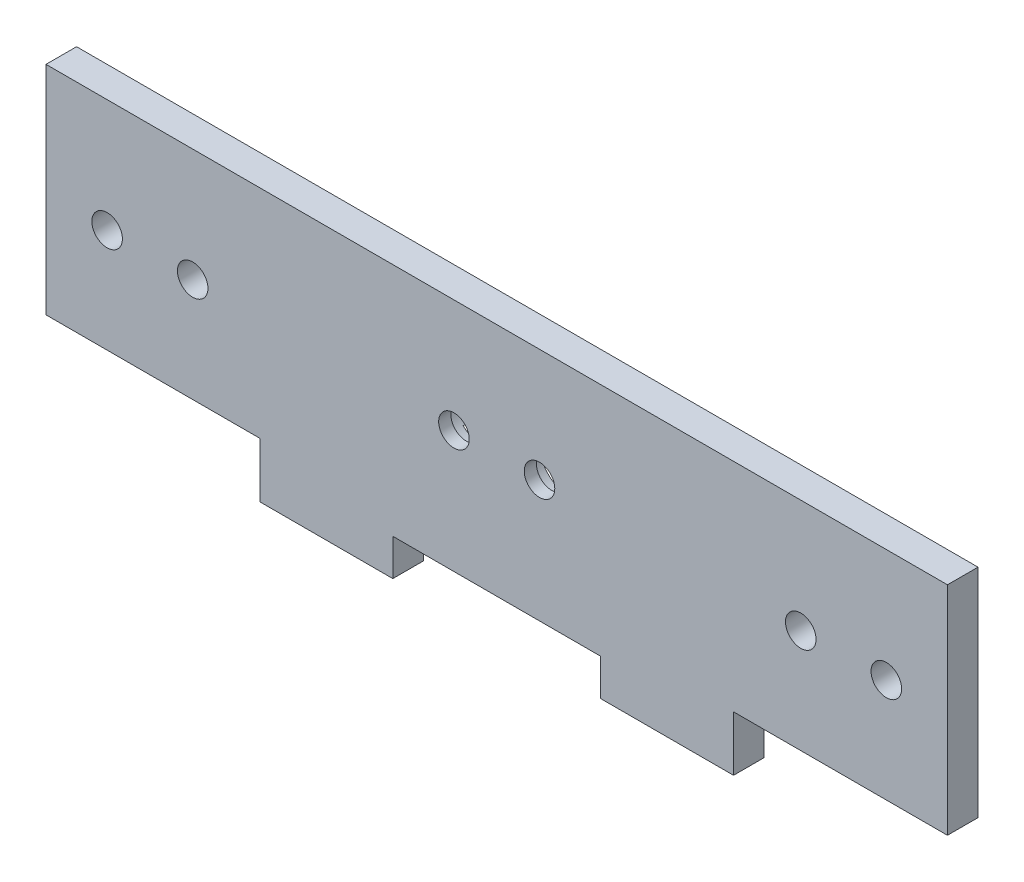
from build123d import *

# Parameters (mm, degrees)
SKETCH1_W           = 147.5
SKETCH1_H           = 53.5
BOSS_EXTRUDE1_DEPTH = 5
SKETCH2_R           = 5
BOSS_EXTRUDE2_DEPTH = 7
SKETCH3_W           = 35
SKETCH3_H           = 18
CUT_EXTRUDE1_DEPTH  = 80.363877173
SKETCH4_W           = 34
SKETCH4_H           = 15
CUT_EXTRUDE2_DEPTH  = 10
SKETCH5_R           = 2.5
CUT_EXTRUDE3_DEPTH  = 80.363877173
SKETCH6_R           = 5
CUT_EXTRUDE4_DEPTH  = 10
SKETCH7_W           = 77.5
SKETCH7_H           = 9
CUT_EXTRUDE5_DEPTH  = 10


with BuildPart() as part:
    # Sketch1 → Boss-Extrude1 (new body)
    with BuildSketch(Plane.XY):
        Rectangle(SKETCH1_W, SKETCH1_H)
    extrude(amount=BOSS_EXTRUDE1_DEPTH)

    # Sketch2 → Boss-Extrude2 (add)
    with BuildSketch(Plane(origin=(0, 0, 0), x_dir=(-1, 0, 0), z_dir=(0, 0, -1))):
        with Locations(Location((12.5, 9.25, 0), (0, 0, 180))):
            Circle(SKETCH2_R)
        with Locations(Location((-12.5, 9.25, 0), (0, 0, 180))):
            Circle(SKETCH2_R)
    extrude(amount=BOSS_EXTRUDE2_DEPTH)

    # Sketch3 → Cut-Extrude1 (cut, through all)
    with BuildSketch(Plane.XY.offset(5)):
        with Locations((-56.25, -17.75)):
            Rectangle(SKETCH3_W, SKETCH3_H)
        with Locations((56.25, -17.75)):
            Rectangle(SKETCH3_W, SKETCH3_H)
    extrude(amount=-CUT_EXTRUDE1_DEPTH, mode=Mode.SUBTRACT)

    # Sketch4 → Cut-Extrude2 (cut)
    with BuildSketch(Plane.XY.offset(5)):
        with Locations((0, -19.25)):
            Rectangle(SKETCH4_W, SKETCH4_H)
    extrude(amount=-CUT_EXTRUDE2_DEPTH, mode=Mode.SUBTRACT)

    # Sketch5 → Cut-Extrude3 (cut, through all)
    with BuildSketch(Plane.XY.offset(5)):
        with Locations((63.75, 8.25)):
            Circle(SKETCH5_R)
        with Locations((49.75, 8.25)):
            Circle(SKETCH5_R)
        with Locations((7, 8.25)):
            Circle(SKETCH5_R)
        with Locations((-49.75, 8.25)):
            Circle(SKETCH5_R)
        with Locations((-63.75, 8.25)):
            Circle(SKETCH5_R)
        with Locations((-7, 8.25)):
            Circle(SKETCH5_R)
    extrude(amount=-CUT_EXTRUDE3_DEPTH, mode=Mode.SUBTRACT)

    # Sketch6 → Cut-Extrude4 (cut)
    with BuildSketch(Plane(origin=(0, 0, -7), x_dir=(-1, 0, 0), z_dir=(0, 0, -1))):
        with Locations((7, 8.25)):
            Circle(SKETCH6_R)
        with Locations((-7, 8.25)):
            Circle(SKETCH6_R)
    extrude(amount=-CUT_EXTRUDE4_DEPTH, mode=Mode.SUBTRACT)

    # Sketch7 → Cut-Extrude5 (cut)
    with BuildSketch(Plane.XY.offset(5)):
        with Locations((0, -22.25)):
            Rectangle(SKETCH7_W, SKETCH7_H)
    extrude(amount=-CUT_EXTRUDE5_DEPTH, mode=Mode.SUBTRACT)


solid = part.part
